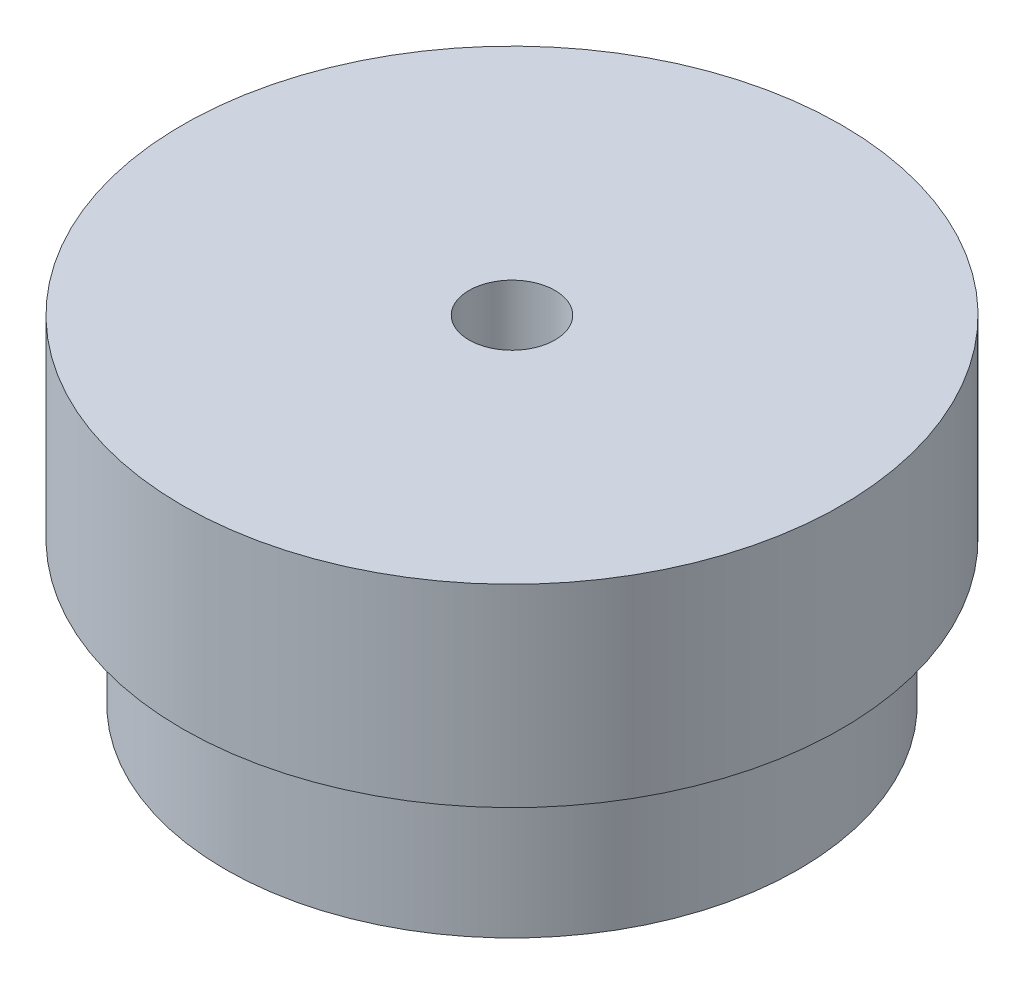
from build123d import *


with BuildPart() as part:
    # Эскиз1 → Повернуть1 (revolve)
    with BuildSketch(Plane(origin=(0, 0, 0), x_dir=(0, 0, -1), z_dir=(1, 0, 0))):
        Polygon((11.5, 0), (11.5, -1.75), (10, -1.75), (10, -6.75), (7.5, -6.75), (7.5, -8.25), (1.5, -8.25), (1.5, 0), (1.5, 5), (11.5, 5), align=None)
    revolve(axis=Axis((0, 0, 0), (0, 1, 0)))


solid = part.part
